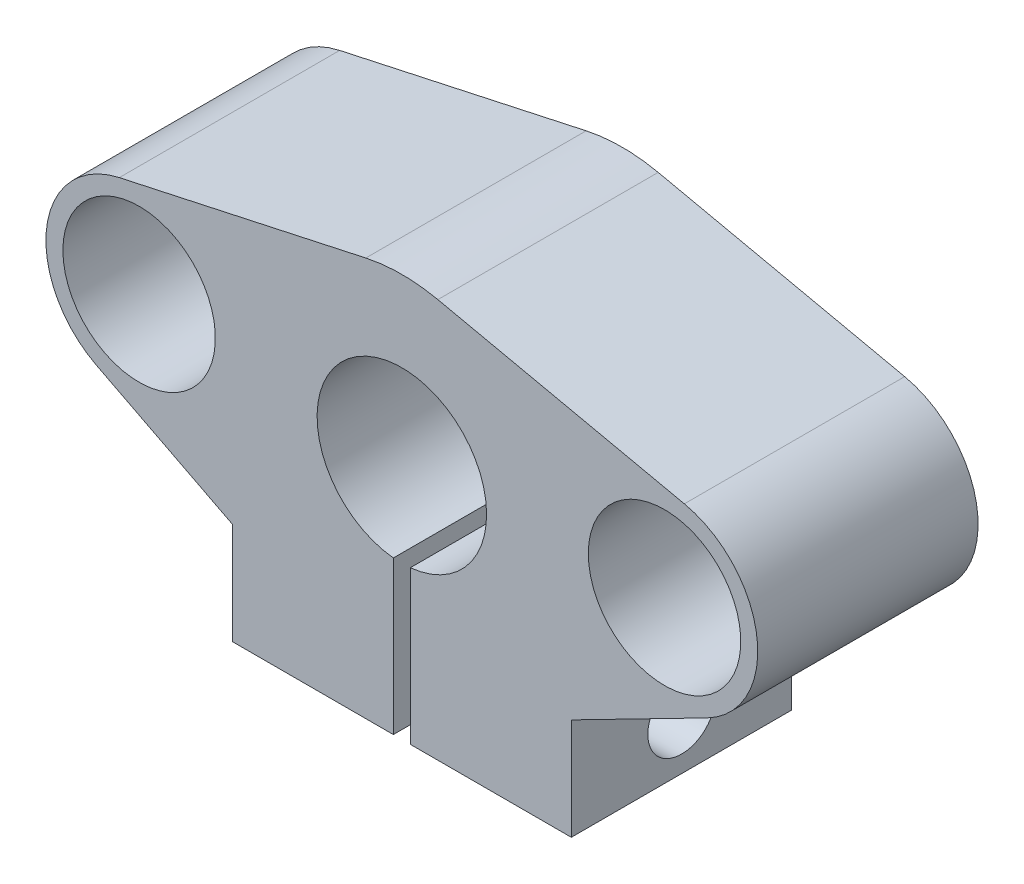
from build123d import *

# Parameters (mm, degrees)
SKETCH_1_R          = 5
SKETCH_1_W          = 19.999962028
SKETCH_1_H          = 6.000037038
EXTRUDE_1_DEPTH     = 13
SKETCH_2_R          = 2
CUT_EXTRUDE_1_DEPTH = 36.693120105
SKETCH_3_W          = 1
SKETCH_3_H          = 13
CUT_EXTRUDE_2_DEPTH = 13
FILLET_1_R          = 10


with BuildPart() as part:
    # 草图1 → 凸台-拉伸1 (new body)
    # profile 1 of 10: a face of its own
    with BuildSketch(Plane.XY):
        with BuildLine():
            ThreePointArc((18.008966142, -1.894393619), (10.046238322, 2.288323413), (16.668970702, 8.374337866))
            Line((16.668970702, 8.374337866), (0, 12))
            Line((0, 12), (-16.6689706, 8.374337888))
            ThreePointArc((-16.6689706, 8.374337888), (-12.048865281, 7.282483993), (-10, 3))
            ThreePointArc((-10, 3), (-12.632014098, -1.693043455), (-18.008966133, -1.894393624))
            Line((-18.008966133, -1.894393624), (-9.999981014, -5.999962962))
            Line((-9.999981014, -5.999962962), (9.999981014, -5.999962962))
            Line((9.999981014, -5.999962962), (18.008966142, -1.894393619))
        make_face()
        with Locations(Location((0, 2, 0), (0, 0, 180))):
            Circle(SKETCH_1_R, mode=Mode.SUBTRACT)
    # profile 2 of 10: a face of its own
    with BuildSketch(Plane.XY):
        with BuildLine():
            ThreePointArc((-10, 3), (-12.048865281, 7.282483993), (-16.6689706, 8.374337888))
            ThreePointArc((-16.6689706, 8.374337888), (-18.13580723, 7.827268404), (-19.389087297, 6.889087297))
            Line((-19.389087297, 6.889087297), (-18.680885962, 6.180885962))
            ThreePointArc((-18.680885962, 6.180885962), (-13.778516922, 7.156027793), (-11.001547932, 3))
            ThreePointArc((-11.001547932, 3), (-13.778516922, -1.156027793), (-18.680885962, -0.180885962))
            Line((-18.680885962, -0.180885962), (-19.389087297, -0.889087297))
            ThreePointArc((-19.389087297, -0.889087297), (-18.738276104, -1.445623452), (-18.008966133, -1.894393624))
            ThreePointArc((-18.008966133, -1.894393624), (-12.632014098, -1.693043455), (-10, 3))
        make_face()
    # profile 3 of 10: a face of its own
    with BuildSketch(Plane.XY):
        with BuildLine():
            Line((-18.680885962, 6.180885962), (-19.389087297, 6.889087297))
            ThreePointArc((-19.389087297, 6.889087297), (-20.581337429, 5.104758878), (-21, 3))
            ThreePointArc((-21, 3), (-20.581337429, 0.895241122), (-19.389087297, -0.889087297))
            Line((-19.389087297, -0.889087297), (-18.680885962, -0.180885962))
            ThreePointArc((-18.680885962, -0.180885962), (-19.998452068, 3), (-18.680885962, 6.180885962))
        make_face()
    # profile 4 of 10: a face of its own
    with BuildSketch(Plane.XY):
        with BuildLine():
            ThreePointArc((-10, 3), (-12.048865281, 7.282483993), (-16.6689706, 8.374337888))
            ThreePointArc((-16.6689706, 8.374337888), (-18.13580723, 7.827268404), (-19.389087297, 6.889087297))
            Line((-19.389087297, 6.889087297), (-18.680885962, 6.180885962))
            ThreePointArc((-18.680885962, 6.180885962), (-13.778516922, 7.156027793), (-11.001547932, 3))
            ThreePointArc((-11.001547932, 3), (-13.778516922, -1.156027793), (-18.680885962, -0.180885962))
            Line((-18.680885962, -0.180885962), (-19.389087297, -0.889087297))
            ThreePointArc((-19.389087297, -0.889087297), (-18.738276104, -1.445623452), (-18.008966133, -1.894393624))
            ThreePointArc((-18.008966133, -1.894393624), (-12.632014098, -1.693043455), (-10, 3))
        make_face()
    # profile 5 of 10: a face of its own
    with BuildSketch(Plane.XY):
        with BuildLine():
            Line((-18.680885962, 6.180885962), (-19.389087297, 6.889087297))
            ThreePointArc((-19.389087297, 6.889087297), (-20.581337429, 5.104758878), (-21, 3))
            ThreePointArc((-21, 3), (-20.581337429, 0.895241122), (-19.389087297, -0.889087297))
            Line((-19.389087297, -0.889087297), (-18.680885962, -0.180885962))
            ThreePointArc((-18.680885962, -0.180885962), (-19.998452068, 3), (-18.680885962, 6.180885962))
        make_face()
    # profile 6 of 10: a face of its own
    with BuildSketch(Plane.XY):
        with BuildLine():
            ThreePointArc((18.680885962, -0.180885962), (11.001547932, 3), (18.680885962, 6.180885962))
            Line((18.680885962, 6.180885962), (19.389087297, 6.889087297))
            ThreePointArc((19.389087297, 6.889087297), (18.135807275, 7.82726838), (16.668970702, 8.374337866))
            ThreePointArc((16.668970702, 8.374337866), (10.046238322, 2.288323413), (18.008966142, -1.894393619))
            ThreePointArc((18.008966142, -1.894393619), (18.738276108, -1.445623449), (19.389087297, -0.889087297))
            Line((19.389087297, -0.889087297), (18.680885962, -0.180885962))
        make_face()
    # profile 7 of 10: a face of its own
    with BuildSketch(Plane.XY):
        with BuildLine():
            Line((19.389087297, 6.889087297), (18.680885962, 6.180885962))
            ThreePointArc((18.680885962, 6.180885962), (19.656027793, 4.721483078), (19.998452068, 3))
            ThreePointArc((19.998452068, 3), (19.656027793, 1.278516922), (18.680885962, -0.180885962))
            Line((18.680885962, -0.180885962), (19.389087297, -0.889087297))
            ThreePointArc((19.389087297, -0.889087297), (20.581337429, 0.895241122), (21, 3))
            ThreePointArc((21, 3), (20.581337429, 5.104758878), (19.389087297, 6.889087297))
        make_face()
    # profile 8 of 10: a face of its own
    with BuildSketch(Plane.XY):
        with BuildLine():
            ThreePointArc((18.680885962, -0.180885962), (11.001547932, 3), (18.680885962, 6.180885962))
            Line((18.680885962, 6.180885962), (19.389087297, 6.889087297))
            ThreePointArc((19.389087297, 6.889087297), (18.135807275, 7.82726838), (16.668970702, 8.374337866))
            ThreePointArc((16.668970702, 8.374337866), (10.046238322, 2.288323413), (18.008966142, -1.894393619))
            ThreePointArc((18.008966142, -1.894393619), (18.738276108, -1.445623449), (19.389087297, -0.889087297))
            Line((19.389087297, -0.889087297), (18.680885962, -0.180885962))
        make_face()
    # profile 9 of 10: a face of its own
    with BuildSketch(Plane.XY):
        with BuildLine():
            Line((19.389087297, 6.889087297), (18.680885962, 6.180885962))
            ThreePointArc((18.680885962, 6.180885962), (19.656027793, 4.721483078), (19.998452068, 3))
            ThreePointArc((19.998452068, 3), (19.656027793, 1.278516922), (18.680885962, -0.180885962))
            Line((18.680885962, -0.180885962), (19.389087297, -0.889087297))
            ThreePointArc((19.389087297, -0.889087297), (20.581337429, 0.895241122), (21, 3))
            ThreePointArc((21, 3), (20.581337429, 5.104758878), (19.389087297, 6.889087297))
        make_face()
    # profile 10 of 10: a face of its own
    with BuildSketch(Plane.XY):
        with Locations((0, -8.999981481)):
            Rectangle(SKETCH_1_W, SKETCH_1_H)
    extrude(amount=EXTRUDE_1_DEPTH)

    # 草图2 → 切除-拉伸1 (cut, through all)
    with BuildSketch(Plane.ZY.offset(9.999981014)):
        with Locations((6.487900744, -8.999981481)):
            Circle(SKETCH_2_R)
    extrude(amount=-CUT_EXTRUDE_1_DEPTH, mode=Mode.SUBTRACT)

    # 草图3 → 切除-拉伸2 (cut)
    with BuildSketch(Plane.XZ.offset(12)):
        with Locations((0, 6.5)):
            Rectangle(SKETCH_3_W, SKETCH_3_H)
    extrude(amount=-CUT_EXTRUDE_2_DEPTH, mode=Mode.SUBTRACT)

    # 圆角1
    fillet_1_edges = [part.edges().sort_by_distance(p)[0] for p in [
        (0, 12, 6.5),
    ]]
    fillet(fillet_1_edges, radius=FILLET_1_R)


solid = part.part
